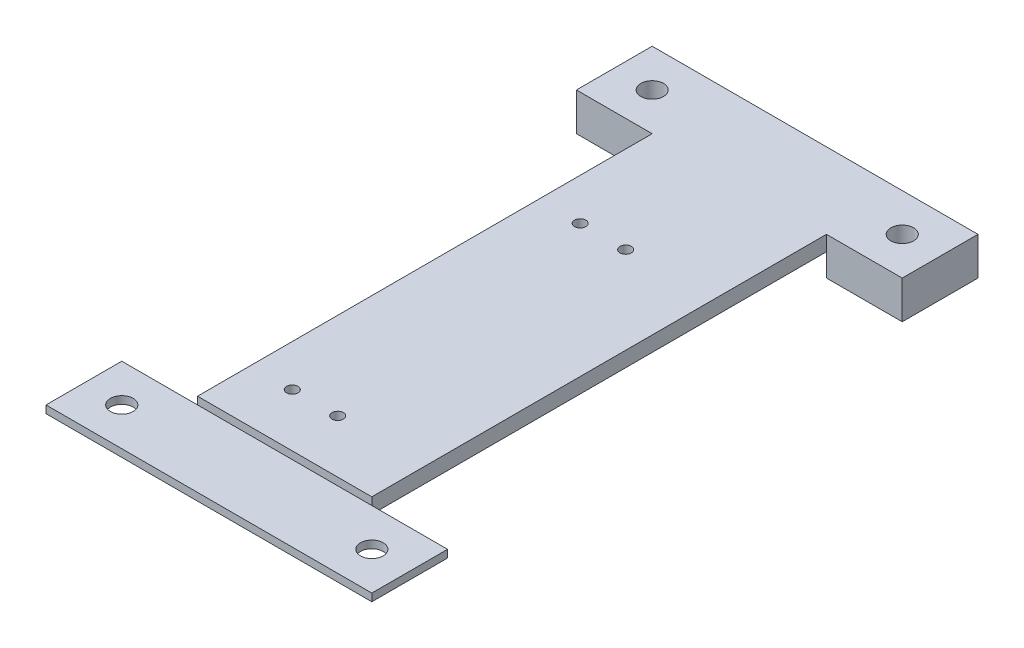
from build123d import *
from build123d.topology import SkipClean

# Parameters (mm, degrees)
SKETCH1_R           = 3
BOSS_EXTRUDE1_DEPTH = 4
BOSS_EXTRUDE3_START = 6
SKETCH8_W           = 20
SKETCH8_H           = 20
SKETCH8_R           = 3
BOSS_EXTRUDE3_DEPTH = 6
SKETCH9_R           = 1.5
CUT_EXTRUDE5_DEPTH  = 6
SKETCH10_W          = 46
SKETCH10_H          = 2
BOSS_EXTRUDE4_DEPTH = 20
SKETCH13_W          = 20
SKETCH13_H          = 2
BOSS_EXTRUDE5_DEPTH = 20
SKETCH14_W          = 20
SKETCH14_H          = 2
BOSS_EXTRUDE7_DEPTH = 20
SKETCH15_R          = 3
CUT_EXTRUDE7_DEPTH  = 20


with BuildPart() as part:
    # Sketch1 → Boss-Extrude1 (new body)
    with BuildSketch(Plane(origin=(0, 0, 0), x_dir=(1, 0, 0), z_dir=(0, 1, 0))):
        Polygon((0, 140), (86, 140), (86, 120), (66, 120), (66, 0), (20, 0), (20, 120), (0, 120), align=None)
        with Locations(Location((10, 130, 0), (0, 0, 270))):
            Circle(SKETCH1_R, mode=Mode.SUBTRACT)
        with Locations(Location((76, 130, 0), (0, 0, 270))):
            Circle(SKETCH1_R, mode=Mode.SUBTRACT)
    extrude(amount=BOSS_EXTRUDE1_DEPTH)

    # Sketch8 → Boss-Extrude3 (add)
    # profile 1 of 2: a face of its own
    with SkipClean():  # the faces are left unmerged after this step: merging them gives an invalid solid
        with BuildSketch(Plane.XZ.offset(BOSS_EXTRUDE3_START)):
            with Locations((10, -130)):
                Rectangle(SKETCH8_W, SKETCH8_H)
            with Locations(Location((10, -130, 0), (0, 0, 270))):
                Circle(SKETCH8_R, mode=Mode.SUBTRACT)
        # profile 2 of 2: a face of its own
        with BuildSketch(Plane.XZ.offset(BOSS_EXTRUDE3_START)):
            with Locations((76, -130)):
                Rectangle(SKETCH8_W, SKETCH8_H)
            with Locations(Location((76, -130, 0), (0, 0, 270))):
                Circle(SKETCH8_R, mode=Mode.SUBTRACT)
        extrude(amount=-BOSS_EXTRUDE3_DEPTH)

    # Sketch9 → Cut-Extrude5 (cut)
    with SkipClean():  # the faces are left unmerged after this step: merging them gives an invalid solid
        with BuildSketch(Plane(origin=(0, 4, 0), x_dir=(1, 0, 0), z_dir=(0, 1, 0))):
            with Locations(Location((31, 90, 0), (0, 0, 270))):
                Circle(SKETCH9_R)
            with Locations(Location((43, 90, 0), (0, 0, 270))):
                Circle(SKETCH9_R)
            with Locations(Location((31, 14, 0), (0, 0, 270))):
                Circle(SKETCH9_R)
            with Locations(Location((43, 14, 0), (0, 0, 270))):
                Circle(SKETCH9_R)
        extrude(amount=-CUT_EXTRUDE5_DEPTH, mode=Mode.SUBTRACT)

    # Sketch10 → Boss-Extrude4 (add)
    with SkipClean():  # the faces are left unmerged after this step: merging them gives an invalid solid
        with BuildSketch(Plane.XY):
            with Locations((43, 1)):
                Rectangle(SKETCH10_W, SKETCH10_H)
        extrude(amount=BOSS_EXTRUDE4_DEPTH)

    # Sketch13 → Boss-Extrude5 (add)
    with SkipClean():  # the faces are left unmerged after this step: merging them gives an invalid solid
        with BuildSketch(Plane(origin=(66, 0, 0), x_dir=(0, 0, -1), z_dir=(1, 0, 0))):
            with Locations((-10, 1)):
                Rectangle(SKETCH13_W, SKETCH13_H)
        extrude(amount=BOSS_EXTRUDE5_DEPTH)

    # Sketch14 → Boss-Extrude7 (add)
    with SkipClean():  # the faces are left unmerged after this step: merging them gives an invalid solid
        with BuildSketch(Plane.ZY.offset(-20)):
            with Locations((10, 1)):
                Rectangle(SKETCH14_W, SKETCH14_H)
        extrude(amount=BOSS_EXTRUDE7_DEPTH)

    # Sketch15 → Cut-Extrude7 (cut)
    with SkipClean():  # the faces are left unmerged after this step: merging them gives an invalid solid
        with BuildSketch(Plane(origin=(0, 2, 0), x_dir=(1, 0, 0), z_dir=(0, 1, 0))):
            with Locations(Location((10, -10, 0), (0, 0, 270))):
                Circle(SKETCH15_R)
            with Locations(Location((76, -10, 0), (0, 0, 270))):
                Circle(SKETCH15_R)
        extrude(amount=-CUT_EXTRUDE7_DEPTH, mode=Mode.SUBTRACT)


solid = part.part
